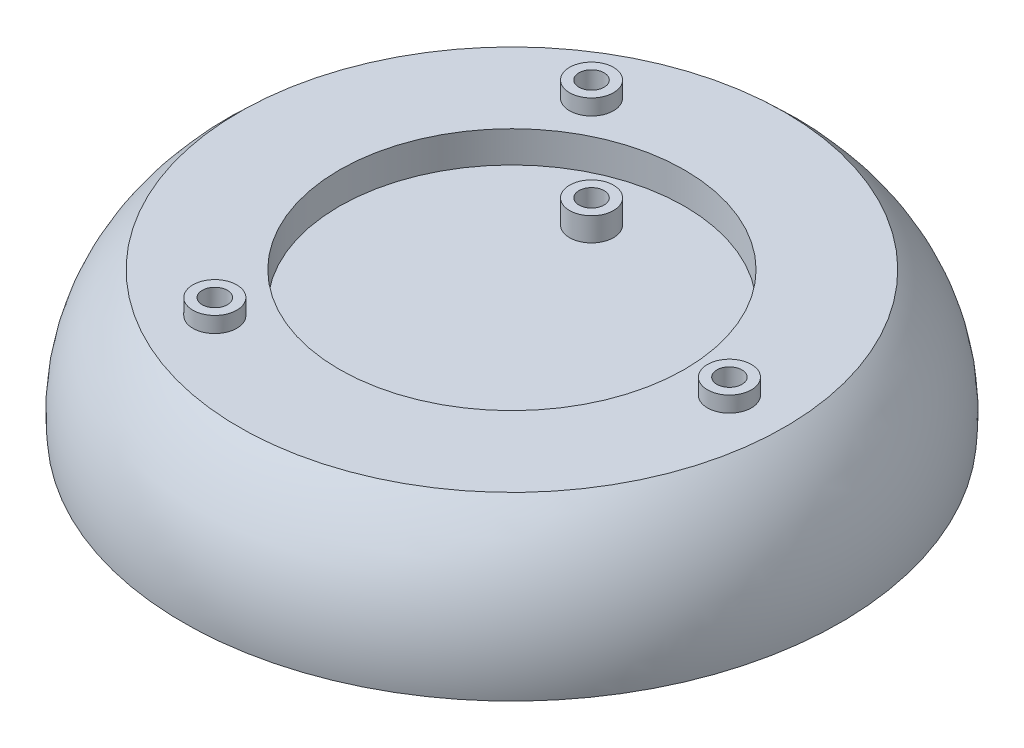
from build123d import *

# Parameters (mm, degrees)
SKETCH4_R           = 4
CUT_EXTRUDE1_DEPTH  = 35
SKETCH5_R           = 7
SKETCH5_R_2         = 4
BOSS_EXTRUDE1_DEPTH = 7.5
SKETCH6_R           = 7
SKETCH6_R_2         = 4
BOSS_EXTRUDE3_DEPTH = 5


with BuildPart() as part:
    # Sketch2 → Revolve-Thin7 (revolve)
    with BuildSketch(Plane(origin=(0, 0, 0), x_dir=(0, 0, -1), z_dir=(1, 0, 0)), mode=Mode.PRIVATE) as revolve_thin7_sk:
        with BuildLine():
            Line((0, 5), (-94.77522535, 5))
            ThreePointArc((-94.77522535, 5), (-90.99735594, 18.501939345), (-82.974310102, 30))
            Line((-82.974310102, 30), (-55, 30))
            Line((-55, 30), (-55, 40))
            Line((-55, 40), (-86.90441422, 40))
            ThreePointArc((-86.90441422, 40), (-101.369835612, 19.701900438), (-104.698104926, -5))
            Line((-104.698104926, -5), (0, -5))
            Line((0, -5), (0, 5))
        make_face()
    revolve(revolve_thin7_sk.sketch.rotate(Axis((0, 0, 0), (0, 1, 0)), 180), axis=Axis((0, 0, 0), (0, 1, 0)))

    # Sketch4 → Cut-Extrude1 (cut)
    with BuildSketch(Plane(origin=(0, 5, 0), x_dir=(1, 0, 0), z_dir=(0, 1, 0))):
        with Locations(Location((69.282032303, 0, 0), (0, 0, 90))):
            Circle(SKETCH4_R)
        with Locations(Location((-34.641016151, 60, 0), (0, 0, 90))):
            Circle(SKETCH4_R)
        with Locations(Location((-34.641016151, -60, 0), (0, 0, 90))):
            Circle(SKETCH4_R)
    extrude(amount=CUT_EXTRUDE1_DEPTH, mode=Mode.SUBTRACT)

    # Sketch5 → Boss-Extrude1 (add)
    # profile 1 of 3: a face of its own
    with BuildSketch(Plane(origin=(0, 5, 0), x_dir=(1, 0, 0), z_dir=(0, 1, 0))):
        with Locations(Location((-34.641016151, 60, 0), (0, 0, 270))):
            Circle(SKETCH5_R)
        with Locations(Location((-34.641016151, 60, 0), (0, 0, 90))):
            Circle(SKETCH5_R_2, mode=Mode.SUBTRACT)
    # profile 2 of 3: a face of its own
    with BuildSketch(Plane(origin=(0, 5, 0), x_dir=(1, 0, 0), z_dir=(0, 1, 0))):
        with Locations(Location((-34.641016151, -60, 0), (0, 0, 270))):
            Circle(SKETCH5_R)
        with Locations(Location((-34.641016151, -60, 0), (0, 0, 90))):
            Circle(SKETCH5_R_2, mode=Mode.SUBTRACT)
    # profile 3 of 3: a face of its own
    with BuildSketch(Plane(origin=(0, 5, 0), x_dir=(1, 0, 0), z_dir=(0, 1, 0))):
        with Locations(Location((69.282032303, 0, 0), (0, 0, 270))):
            Circle(SKETCH5_R)
        with Locations(Location((69.282032303, 0, 0), (0, 0, 90))):
            Circle(SKETCH5_R_2, mode=Mode.SUBTRACT)
    extrude(amount=BOSS_EXTRUDE1_DEPTH)

    # Sketch6 → Boss-Extrude3 (add)
    # profile 1 of 3: a face of its own
    with BuildSketch(Plane(origin=(0, 40, 0), x_dir=(1, 0, 0), z_dir=(0, 1, 0))):
        with Locations(Location((-34.641016151, -60, 0), (0, 0, 270))):
            Circle(SKETCH6_R)
        with Locations(Location((-34.641016151, -60, 0), (0, 0, 90))):
            Circle(SKETCH6_R_2, mode=Mode.SUBTRACT)
    # profile 2 of 3: a face of its own
    with BuildSketch(Plane(origin=(0, 40, 0), x_dir=(1, 0, 0), z_dir=(0, 1, 0))):
        with Locations(Location((-34.641016151, 60, 0), (0, 0, 270))):
            Circle(SKETCH6_R)
        with Locations(Location((-34.641016151, 60, 0), (0, 0, 90))):
            Circle(SKETCH6_R_2, mode=Mode.SUBTRACT)
    # profile 3 of 3: a face of its own
    with BuildSketch(Plane(origin=(0, 40, 0), x_dir=(1, 0, 0), z_dir=(0, 1, 0))):
        with Locations(Location((69.282032303, 0, 0), (0, 0, 270))):
            Circle(SKETCH6_R)
        with Locations(Location((69.282032303, 0, 0), (0, 0, 90))):
            Circle(SKETCH6_R_2, mode=Mode.SUBTRACT)
    extrude(amount=BOSS_EXTRUDE3_DEPTH)


solid = part.part
